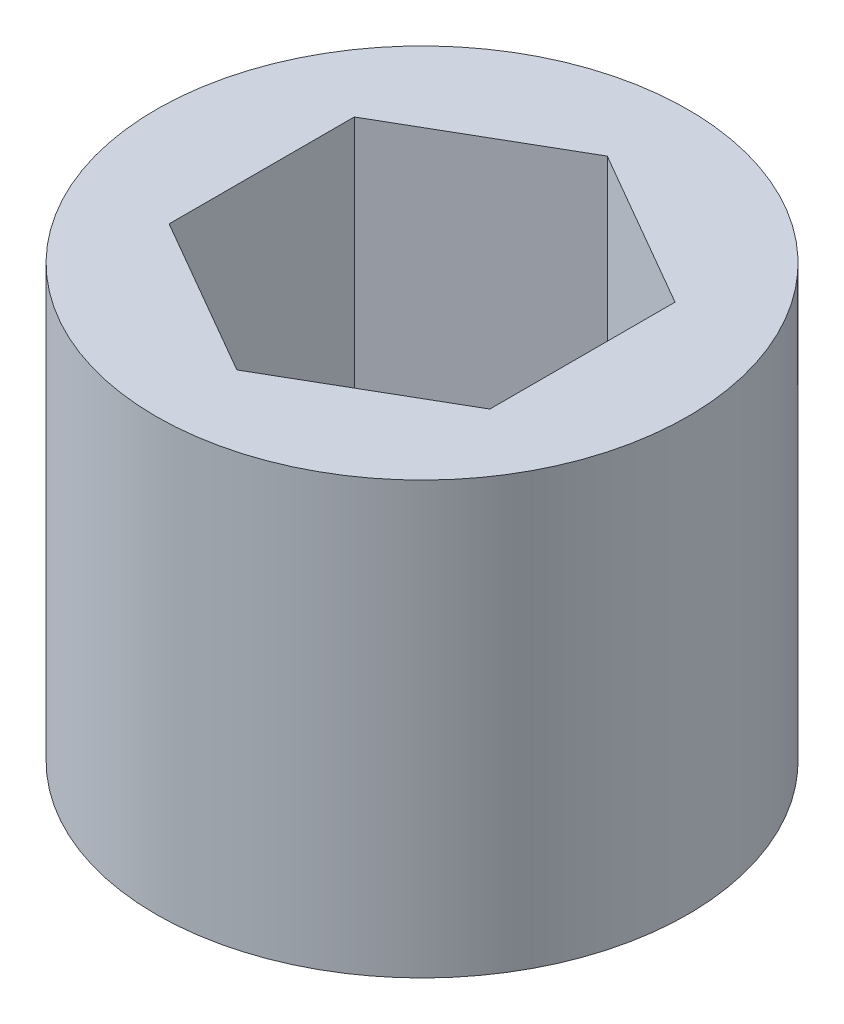
from build123d import *

# Parameters (mm, degrees)
SKETCH1_R           = 7.9375
BOSS_EXTRUDE1_DEPTH = 12.87272


with BuildPart() as part:
    # Sketch1 → Boss-Extrude1 (new body)
    with BuildSketch(Plane(origin=(0, 0, 0), x_dir=(1, 0, 0), z_dir=(0, 1, 0))):
        with Locations(Location((0, 0, 0), (0, 0, 270))):
            Circle(SKETCH1_R)
        Polygon((0, 5.528590708), (-4.7879, 2.764295354), (-4.7879, -2.764295354), (0, -5.528590708), (4.7879, -2.764295354), (4.7879, 2.764295354), align=None, mode=Mode.SUBTRACT)
    extrude(amount=BOSS_EXTRUDE1_DEPTH)


solid = part.part
